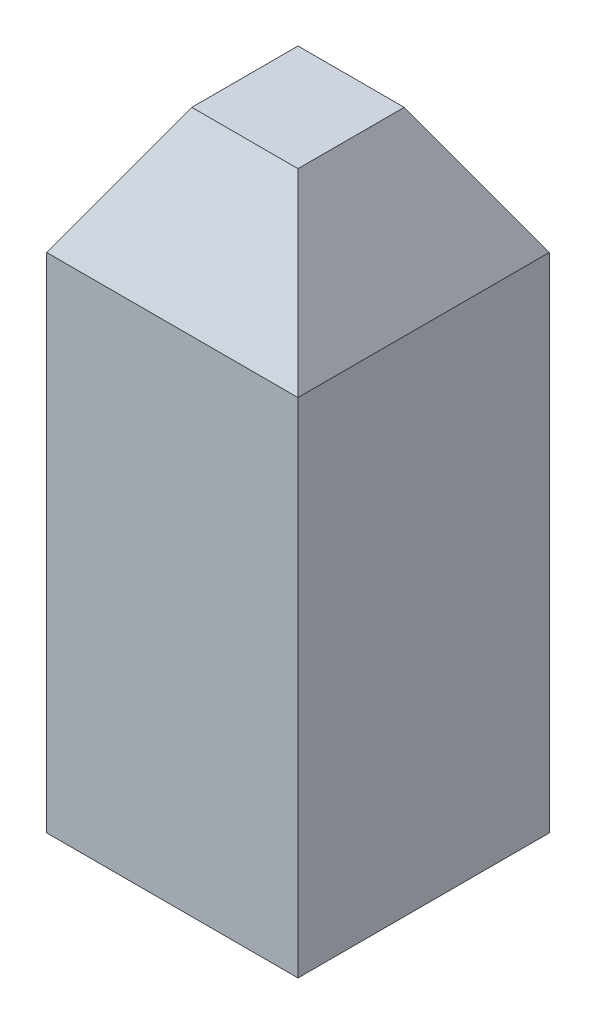
from build123d import *

# Parameters (mm, degrees)
SKETCH1_W           = 0.5
SKETCH1_H           = 0.5
BOSS_EXTRUDE1_DEPTH = 0.5
SKETCH2_W           = 0.5
SKETCH2_H           = 0.5
BOSS_EXTRUDE2_DEPTH = 0.25
BOSS_EXTRUDE2_TAPER = 30


with BuildPart() as part:
    # Sketch1 → Boss-Extrude1 (new, symmetric)
    with BuildSketch(Plane(origin=(0, 0, 0), x_dir=(1, 0, 0), z_dir=(0, 1, 0))):
        Rectangle(SKETCH1_W, SKETCH1_H)
    extrude(amount=BOSS_EXTRUDE1_DEPTH, both=True)

    # Sketch2 → Boss-Extrude2 (add)
    with BuildSketch(Plane(origin=(0, 0.5, 0), x_dir=(1, 0, 0), z_dir=(0, 1, 0))):
        Rectangle(SKETCH2_W, SKETCH2_H)
    extrude(amount=BOSS_EXTRUDE2_DEPTH, taper=BOSS_EXTRUDE2_TAPER)


solid = part.part
